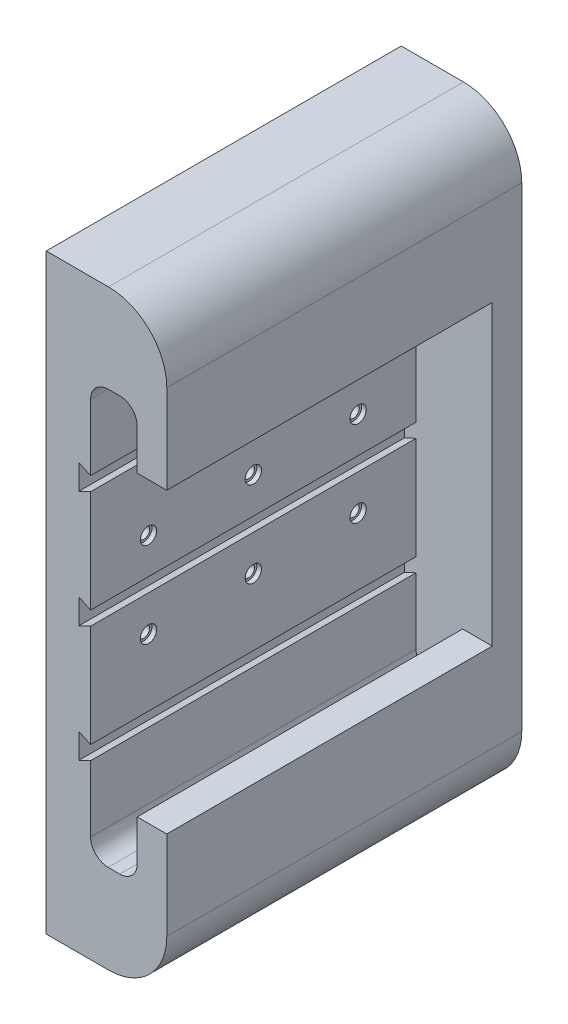
from build123d import *

# Parameters (mm, degrees)
BOSS_EXTRUDE1_DEPTH = 152.4
BOSS_EXTRUDE2_DEPTH = 12.7
SKETCH3_R           = 2.5
CUT_EXTRUDE1_DEPTH  = 25
SKETCH4_R           = 3.5
CUT_EXTRUDE2_DEPTH  = 2


with BuildPart() as part:
    # Sketch1 → Boss-Extrude1 (new body)
    with BuildSketch(Plane(origin=(0, 0, 0), x_dir=(0, 1, 0), z_dir=(0, 0, 1))):
        with BuildLine():
            Line((-94.231538291, 5), (-88.9, 5))
            Line((-88.9, 5), (-88.9, 19.05))
            Line((-88.9, 19.05), (-215.9, 19.05))
            Line((-215.9, 19.05), (-215.9, -7.7))
            ThreePointArc((-215.9, -7.7), (-208.57766953, -25.37766953), (-190.9, -32.7))
            Line((-190.9, -32.7), (-152.8, -32.7))
            Line((-152.8, -32.7), (-152.8, -20))
            Line((-152.8, -20), (-170.3, -20))
            ThreePointArc((-170.3, -20), (-175.603300859, -17.803300859), (-177.8, -12.5))
            Line((-177.8, -12.5), (-177.8, -7.5))
            ThreePointArc((-177.8, -7.5), (-175.603300859, -2.196699141), (-170.3, 0))
            Line((-170.3, 0), (-141.9, 0))
            Line((-141.9, 0), (-144.231538291, 5))
            Line((-144.231538291, 5), (-133.568461709, 5))
            Line((-133.568461709, 5), (-135.9, 0))
            Line((-135.9, 0), (-91.9, 0))
            Line((-91.9, 0), (-94.231538291, 5))
        make_face()
        with BuildLine():
            Line((-35.9, 0), (-7.5, 0))
            ThreePointArc((-7.5, 0), (-2.196699141, -2.196699141), (0, -7.5))
            Line((0, -7.5), (0, -12.5))
            ThreePointArc((0, -12.5), (-2.196699141, -17.803300859), (-7.5, -20))
            Line((-7.5, -20), (-25, -20))
            Line((-25, -20), (-25, -32.7))
            Line((-25, -32.7), (13.1, -32.7))
            ThreePointArc((13.1, -32.7), (30.77766953, -25.37766953), (38.1, -7.7))
            Line((38.1, -7.7), (38.1, 19.05))
            Line((38.1, 19.05), (-88.9, 19.05))
            Line((-88.9, 19.05), (-88.9, 5))
            Line((-88.9, 5), (-83.568461709, 5))
            Line((-83.568461709, 5), (-85.9, 0))
            Line((-85.9, 0), (-41.9, 0))
            Line((-41.9, 0), (-44.231538291, 5))
            Line((-44.231538291, 5), (-33.568461709, 5))
            Line((-33.568461709, 5), (-35.9, 0))
        make_face()
    extrude(amount=BOSS_EXTRUDE1_DEPTH)

    # Sketch2 → Boss-Extrude2 (add)
    with BuildSketch(Plane(origin=(0, 0, 0), x_dir=(1, 0, 0), z_dir=(0, 0, -1))):
        Polygon((-19.05, 215.9), (-19.05, -38.1), (7.7, -38.1), (32.7, 25), (32.7, 152.8), (32.7, 190.9), (7.7, 215.9), align=None)
    extrude(amount=-BOSS_EXTRUDE2_DEPTH)

    # Sketch3 → Cut-Extrude1 (cut)
    with BuildSketch(Plane.YZ):
        with Locations(Location((-107.285735893, 82.55, 0), (0, 0, 270))):
            Circle(SKETCH3_R)
        with Locations(Location((-107.285735893, 127.55, 0), (0, 0, 270))):
            Circle(SKETCH3_R)
        with Locations(Location((-107.285735893, 37.55, 0), (0, 0, 270))):
            Circle(SKETCH3_R)
        with Locations(Location((-70.514264107, 37.55, 0), (0, 0, 180))):
            Circle(SKETCH3_R)
        with Locations(Location((-70.514264107, 82.55, 0), (0, 0, 180))):
            Circle(SKETCH3_R)
        with Locations(Location((-70.514264107, 127.55, 0), (0, 0, 180))):
            Circle(SKETCH3_R)
    extrude(amount=-CUT_EXTRUDE1_DEPTH, mode=Mode.SUBTRACT)

    # Sketch4 → Cut-Extrude2 (cut)
    with BuildSketch(Plane.YZ):
        with Locations(Location((-107.285735893, 127.55, 0), (0, 0, 270))):
            Circle(SKETCH4_R)
        with Locations(Location((-107.285735893, 82.55, 0), (0, 0, 270))):
            Circle(SKETCH4_R)
        with Locations(Location((-107.285735893, 37.55, 0), (0, 0, 270))):
            Circle(SKETCH4_R)
        with Locations(Location((-70.514264107, 37.55, 0), (0, 0, 270))):
            Circle(SKETCH4_R)
        with Locations(Location((-70.514264107, 82.55, 0), (0, 0, 270))):
            Circle(SKETCH4_R)
        with Locations(Location((-70.514264107, 127.55, 0), (0, 0, 270))):
            Circle(SKETCH4_R)
    extrude(amount=-CUT_EXTRUDE2_DEPTH, mode=Mode.SUBTRACT)


solid = part.part
